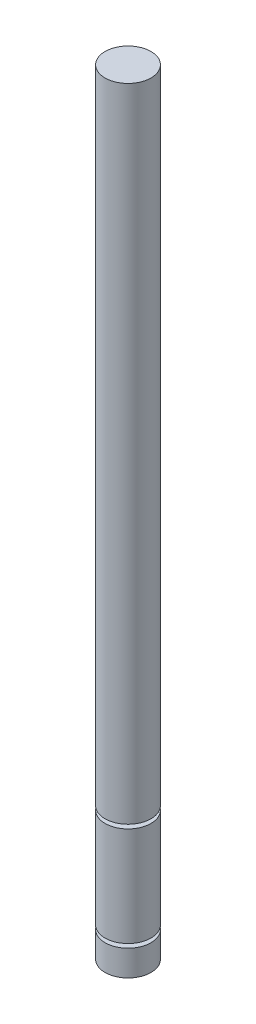
from build123d import *

# Parameters (mm, degrees)
SKETCH1_R           = 4
BOSS_EXTRUDE1_DEPTH = 135
SKETCH2_W           = 1
SKETCH2_H           = 0.7
LPATTERN1_COUNT     = 2
LPATTERN1_PITCH     = 18


with BuildPart() as part:
    # Sketch1 → Boss-Extrude1 (new body)
    with BuildSketch(Plane(origin=(0, 0, 0), x_dir=(1, 0, 0), z_dir=(0, 1, 0))):
        with Locations(Location((0, 0, 0), (0, 0, 270))):
            Circle(SKETCH1_R)
    extrude(amount=BOSS_EXTRUDE1_DEPTH)

    # Sketch2 → Cut-Revolve1 (revolve, cut)
    with BuildSketch(Plane.XY, mode=Mode.PRIVATE) as cut_revolve1_sk:
        with Locations((-3.5, 4.85)):
            Rectangle(SKETCH2_W, SKETCH2_H)
    cut_revolve1 = revolve(cut_revolve1_sk.sketch.rotate(Axis((0, 0, 0), (0, 1, 0)), 270), axis=Axis((0, 0, 0), (0, 1, 0)), mode=Mode.SUBTRACT)

    # LPattern1: Cut-Revolve1 ×2
    with Locations(*[(0, i * LPATTERN1_PITCH, 0) for i in range(1, LPATTERN1_COUNT)]):
        add(cut_revolve1, mode=Mode.SUBTRACT)


solid = part.part
